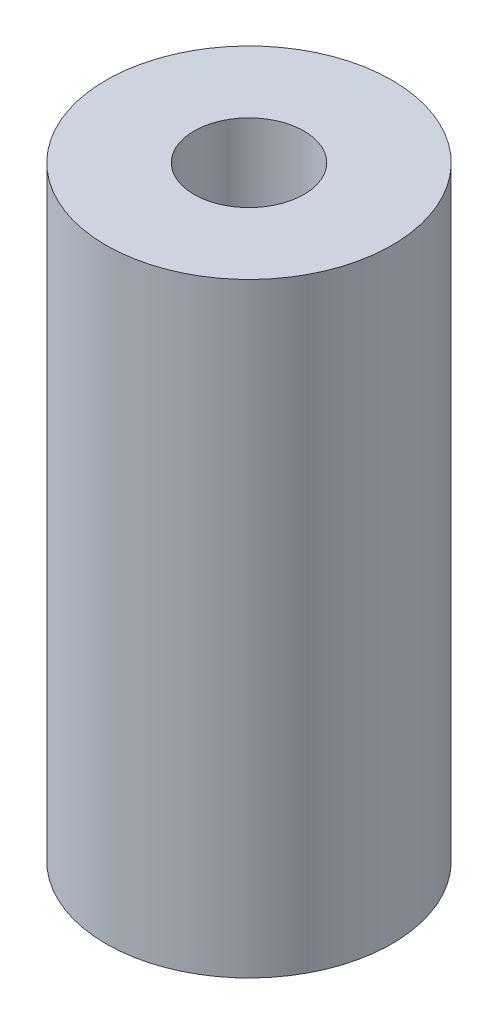
from build123d import *

# Parameters (mm, degrees)
SKETCH_1_R      = 2.6
SKETCH_1_R_2    = 1
EXTRUDE_1_DEPTH = 11


with BuildPart() as part:
    # Эскиз1 → Бобышка-Вытянуть1 (new body)
    with BuildSketch(Plane(origin=(0, 0, 0), x_dir=(1, 0, 0), z_dir=(0, 1, 0))):
        with Locations(Location((0, 0, 0), (0, 0, 270))):
            Circle(SKETCH_1_R)
        with Locations(Location((0, 0, 0), (0, 0, 270))):
            Circle(SKETCH_1_R_2, mode=Mode.SUBTRACT)
    extrude(amount=EXTRUDE_1_DEPTH)


solid = part.part
